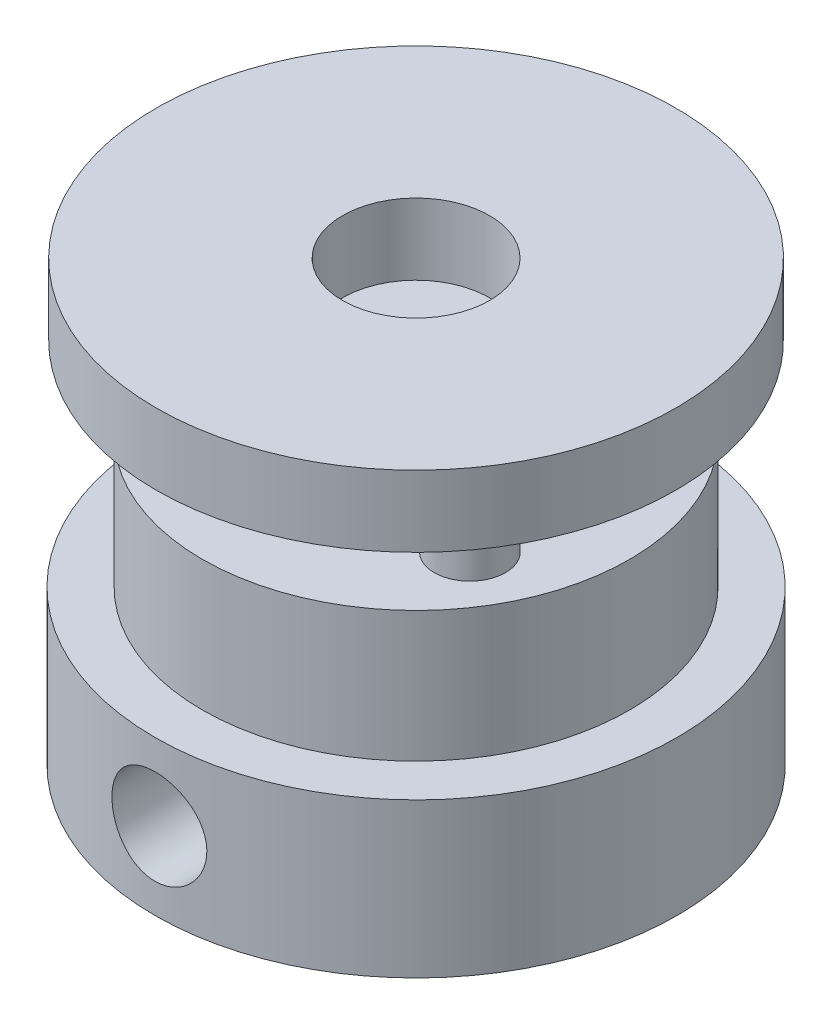
from build123d import *

# Parameters (mm, degrees)
SKETCH1_R           = 11
BOSS_EXTRUDE1_DEPTH = 6.5
SKETCH2_R           = 9
BOSS_EXTRUDE2_DEPTH = 5.5
SKETCH3_R           = 3
CUT_EXTRUDE1_DEPTH  = 20.646882704
SKETCH4_R           = 1.5
BOSS_EXTRUDE3_DEPTH = 3.5
CIRPATTERN1_COUNT   = 3
SKETCH5_R           = 10.95
SKETCH5_R_2         = 3.1
BOSS_EXTRUDE4_DEPTH = 3
SKETCH7_R           = 2
CUT_EXTRUDE2_DEPTH  = 25.171263931


with BuildPart() as part:
    # Sketch1 → Boss-Extrude1 (new body)
    with BuildSketch(Plane(origin=(0, 0, 0), x_dir=(1, 0, 0), z_dir=(0, 1, 0))):
        with Locations(Location((0, 0, 0), (0, 0, 90))):
            Circle(SKETCH1_R)
    extrude(amount=BOSS_EXTRUDE1_DEPTH)

    # Sketch2 → Boss-Extrude2 (add)
    with BuildSketch(Plane(origin=(0, 6.5, 0), x_dir=(1, 0, 0), z_dir=(0, 1, 0))):
        with Locations(Location((0, 0, 0), (0, 0, 270))):
            Circle(SKETCH2_R)
    extrude(amount=BOSS_EXTRUDE2_DEPTH)

    # Sketch3 → Cut-Extrude1 (cut, through all)
    with BuildSketch(Plane(origin=(0, 12, 0), x_dir=(1, 0, 0), z_dir=(0, 1, 0))):
        with Locations(Location((0, 0, 0), (0, 0, 270))):
            Circle(SKETCH3_R)
    extrude(amount=-CUT_EXTRUDE1_DEPTH, mode=Mode.SUBTRACT)

    # Sketch4 → Boss-Extrude3 (add)
    with BuildSketch(Plane(origin=(0, 12, 0), x_dir=(1, 0, 0), z_dir=(0, 1, 0))):
        with Locations(Location((0, 6.2, 0), (0, 0, 270))):
            Circle(SKETCH4_R)
    boss_extrude3 = extrude(amount=BOSS_EXTRUDE3_DEPTH)

    # CirPattern1: Boss-Extrude3 ×3 about axis
    cirpattern1_axis = Axis((0, 0, 0), (0, 1, 0))
    for i in range(1, CIRPATTERN1_COUNT):
        add(boss_extrude3.rotate(cirpattern1_axis, i * 360 / CIRPATTERN1_COUNT))

    # Sketch5 → Boss-Extrude4 (add)
    with BuildSketch(Plane(origin=(0, 15.5, 0), x_dir=(1, 0, 0), z_dir=(0, 1, 0))):
        with Locations(Location((0, 0, 0), (0, 0, 270))):
            Circle(SKETCH5_R)
        with Locations(Location((0, 0, 0), (0, 0, 270))):
            Circle(SKETCH5_R_2, mode=Mode.SUBTRACT)
    extrude(amount=BOSS_EXTRUDE4_DEPTH)

    # Sketch7 → Cut-Extrude2 (cut, through all)
    with BuildSketch(Plane.XY):
        with Locations(Location((0, 3.25, 0), (0, 0, 270))):
            Circle(SKETCH7_R)
    extrude(amount=CUT_EXTRUDE2_DEPTH, mode=Mode.SUBTRACT)


solid = part.part
